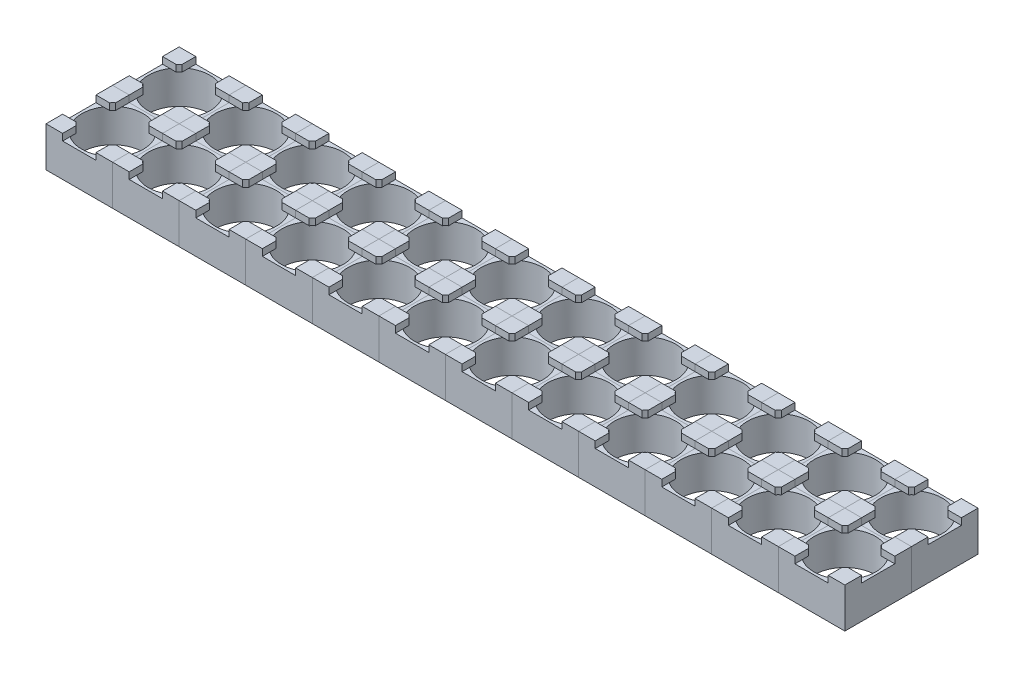
from build123d import *

# Parameters (mm, degrees)
SKETCH_1_W               = 20
SKETCH_1_H               = 20
SKETCH_1_R               = 9.25
EXTRUDE_1_DEPTH          = 10
EXTRUDE_2_DEPTH          = 2
PATTERN_LINEAR_1_COUNT   = 12
PATTERN_LINEAR_1_PITCH   = 20
PATTERN_LINEAR_1_2_COUNT = 2
PATTERN_LINEAR_1_2_PITCH = 20


with BuildPart() as part:
    # 스케치1 → 보스-돌출1 (new body)
    with BuildSketch(Plane(origin=(0, 0, 0), x_dir=(1, 0, 0), z_dir=(0, 1, 0))):
        Rectangle(SKETCH_1_W, SKETCH_1_H)
        with Locations(Location((0, 0, 0), (0, 0, 270))):
            Circle(SKETCH_1_R, mode=Mode.SUBTRACT)
    extrude(amount=EXTRUDE_1_DEPTH)

    # 스케치2 → 보스-돌출2 (add)
    with BuildSketch(Plane(origin=(0, 10, 0), x_dir=(1, 0, 0), z_dir=(0, 1, 0))):
        with BuildLine():
            Line((-5, 10), (-10, 10))
            Line((-10, 10), (-10, 5))
            Line((-10, 5), (-7.782191208, 5))
            ThreePointArc((-7.782191208, 5), (-6.540737726, 6.540737726), (-5, 7.782191208))
            Line((-5, 7.782191208), (-5, 10))
        make_face()
        with BuildLine():
            Line((-5, 5.921359641), (-5, 7.782191208))
            ThreePointArc((-5, 7.782191208), (-6.540737726, 6.540737726), (-7.782191208, 5))
            Line((-7.782191208, 5), (-5.921359641, 5))
            ThreePointArc((-5.921359641, 5), (-5.480077554, 5.480077554), (-5, 5.921359641))
        make_face()
        with BuildLine():
            ThreePointArc((7.782191208, 5), (6.540737726, 6.540737726), (5, 7.782191208))
            Line((5, 7.782191208), (5, 5.921359641))
            ThreePointArc((5, 5.921359641), (5.480077554, 5.480077554), (5.921359641, 5))
            Line((5.921359641, 5), (7.782191208, 5))
        make_face()
        with BuildLine():
            Line((10, 10), (5, 10))
            Line((5, 10), (5, 7.782191208))
            ThreePointArc((5, 7.782191208), (6.540737726, 6.540737726), (7.782191208, 5))
            Line((7.782191208, 5), (10, 5))
            Line((10, 5), (10, 10))
        make_face()
        with BuildLine():
            Line((5, -5.921359641), (5, -7.782191208))
            ThreePointArc((5, -7.782191208), (6.540737726, -6.540737726), (7.782191208, -5))
            Line((7.782191208, -5), (5.921359641, -5))
            ThreePointArc((5.921359641, -5), (5.480077554, -5.480077554), (5, -5.921359641))
        make_face()
        with BuildLine():
            Line((10, -10), (10, -5))
            Line((10, -5), (7.782191208, -5))
            ThreePointArc((7.782191208, -5), (6.540737726, -6.540737726), (5, -7.782191208))
            Line((5, -7.782191208), (5, -10))
            Line((5, -10), (10, -10))
        make_face()
        with BuildLine():
            Line((-7.782191208, -5), (-10, -5))
            Line((-10, -5), (-10, -10))
            Line((-10, -10), (-5, -10))
            Line((-5, -10), (-5, -7.782191208))
            ThreePointArc((-5, -7.782191208), (-6.540737726, -6.540737726), (-7.782191208, -5))
        make_face()
        with BuildLine():
            Line((-5.921359641, -5), (-7.782191208, -5))
            ThreePointArc((-7.782191208, -5), (-6.540737726, -6.540737726), (-5, -7.782191208))
            Line((-5, -7.782191208), (-5, -5.921359641))
            ThreePointArc((-5, -5.921359641), (-5.480077554, -5.480077554), (-5.921359641, -5))
        make_face()
    extrude(amount=EXTRUDE_2_DEPTH)


with BuildPart() as pattern_linear_1_1:
    # 선형 패턴1: pattern copy
    add(part.part.moved(Location(Vector(1, 0, 0) * (1 * PATTERN_LINEAR_1_PITCH))))


with BuildPart() as pattern_linear_1_2:
    # 선형 패턴1: pattern copy
    add(part.part.moved(Location(Vector(1, 0, 0) * (2 * PATTERN_LINEAR_1_PITCH))))


with BuildPart() as pattern_linear_1_3:
    # 선형 패턴1: pattern copy
    add(part.part.moved(Location(Vector(1, 0, 0) * (3 * PATTERN_LINEAR_1_PITCH))))


with BuildPart() as pattern_linear_1_4:
    # 선형 패턴1: pattern copy
    add(part.part.moved(Location(Vector(1, 0, 0) * (4 * PATTERN_LINEAR_1_PITCH))))


with BuildPart() as pattern_linear_1_5:
    # 선형 패턴1: pattern copy
    add(part.part.moved(Location(Vector(1, 0, 0) * (5 * PATTERN_LINEAR_1_PITCH))))


with BuildPart() as pattern_linear_1_6:
    # 선형 패턴1: pattern copy
    add(part.part.moved(Location(Vector(1, 0, 0) * (6 * PATTERN_LINEAR_1_PITCH))))


with BuildPart() as pattern_linear_1_7:
    # 선형 패턴1: pattern copy
    add(part.part.moved(Location(Vector(1, 0, 0) * (7 * PATTERN_LINEAR_1_PITCH))))


with BuildPart() as pattern_linear_1_8:
    # 선형 패턴1: pattern copy
    add(part.part.moved(Location(Vector(1, 0, 0) * (8 * PATTERN_LINEAR_1_PITCH))))


with BuildPart() as pattern_linear_1_9:
    # 선형 패턴1: pattern copy
    add(part.part.moved(Location(Vector(1, 0, 0) * (9 * PATTERN_LINEAR_1_PITCH))))


with BuildPart() as pattern_linear_1_10:
    # 선형 패턴1: pattern copy
    add(part.part.moved(Location(Vector(1, 0, 0) * (10 * PATTERN_LINEAR_1_PITCH))))


with BuildPart() as pattern_linear_1_11:
    # 선형 패턴1: pattern copy
    add(part.part.moved(Location(Vector(1, 0, 0) * (11 * PATTERN_LINEAR_1_PITCH))))


with BuildPart() as pattern_linear_1_2_1:
    # Pattern Linear 1 2: pattern copy
    add(part.part.moved(Location(Vector(0, 0, -1) * (1 * PATTERN_LINEAR_1_2_PITCH))))


with BuildPart() as pattern_linear_1_2_2:
    # Pattern Linear 1 2: pattern copy
    add(pattern_linear_1_1.part.moved(Location(Vector(0, 0, -1) * (1 * PATTERN_LINEAR_1_2_PITCH))))


with BuildPart() as pattern_linear_1_2_3:
    # Pattern Linear 1 2: pattern copy
    add(pattern_linear_1_2.part.moved(Location(Vector(0, 0, -1) * (1 * PATTERN_LINEAR_1_2_PITCH))))


with BuildPart() as pattern_linear_1_2_4:
    # Pattern Linear 1 2: pattern copy
    add(pattern_linear_1_3.part.moved(Location(Vector(0, 0, -1) * (1 * PATTERN_LINEAR_1_2_PITCH))))


with BuildPart() as pattern_linear_1_2_5:
    # Pattern Linear 1 2: pattern copy
    add(pattern_linear_1_4.part.moved(Location(Vector(0, 0, -1) * (1 * PATTERN_LINEAR_1_2_PITCH))))


with BuildPart() as pattern_linear_1_2_6:
    # Pattern Linear 1 2: pattern copy
    add(pattern_linear_1_5.part.moved(Location(Vector(0, 0, -1) * (1 * PATTERN_LINEAR_1_2_PITCH))))


with BuildPart() as pattern_linear_1_2_7:
    # Pattern Linear 1 2: pattern copy
    add(pattern_linear_1_6.part.moved(Location(Vector(0, 0, -1) * (1 * PATTERN_LINEAR_1_2_PITCH))))


with BuildPart() as pattern_linear_1_2_8:
    # Pattern Linear 1 2: pattern copy
    add(pattern_linear_1_7.part.moved(Location(Vector(0, 0, -1) * (1 * PATTERN_LINEAR_1_2_PITCH))))


with BuildPart() as pattern_linear_1_2_9:
    # Pattern Linear 1 2: pattern copy
    add(pattern_linear_1_8.part.moved(Location(Vector(0, 0, -1) * (1 * PATTERN_LINEAR_1_2_PITCH))))


with BuildPart() as pattern_linear_1_2_10:
    # Pattern Linear 1 2: pattern copy
    add(pattern_linear_1_9.part.moved(Location(Vector(0, 0, -1) * (1 * PATTERN_LINEAR_1_2_PITCH))))


with BuildPart() as pattern_linear_1_2_11:
    # Pattern Linear 1 2: pattern copy
    add(pattern_linear_1_10.part.moved(Location(Vector(0, 0, -1) * (1 * PATTERN_LINEAR_1_2_PITCH))))


with BuildPart() as pattern_linear_1_2_12:
    # Pattern Linear 1 2: pattern copy
    add(pattern_linear_1_11.part.moved(Location(Vector(0, 0, -1) * (1 * PATTERN_LINEAR_1_2_PITCH))))


solid = Compound([part.part, pattern_linear_1_1.part, pattern_linear_1_2.part, pattern_linear_1_3.part, pattern_linear_1_4.part, pattern_linear_1_5.part, pattern_linear_1_6.part, pattern_linear_1_7.part, pattern_linear_1_8.part, pattern_linear_1_9.part, pattern_linear_1_10.part, pattern_linear_1_11.part, pattern_linear_1_2_1.part, pattern_linear_1_2_2.part, pattern_linear_1_2_3.part, pattern_linear_1_2_4.part, pattern_linear_1_2_5.part, pattern_linear_1_2_6.part, pattern_linear_1_2_7.part, pattern_linear_1_2_8.part, pattern_linear_1_2_9.part, pattern_linear_1_2_10.part, pattern_linear_1_2_11.part, pattern_linear_1_2_12.part])
